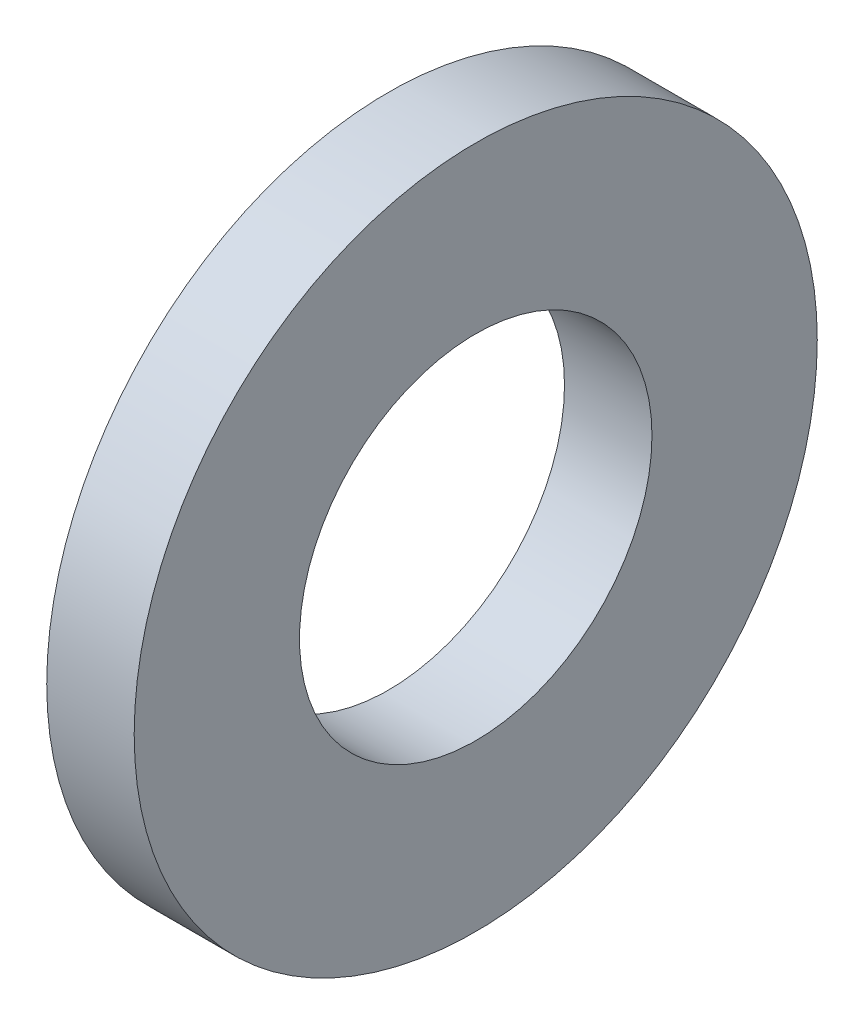
from build123d import *

# Parameters (mm, degrees)
SKETCH1_R          = 3.905
SKETCH1_R_2        = 2.015
BASE_EXTRUDE_DEPTH = 1


with BuildPart() as part:
    # Sketch1 → Base-Extrude (new body)
    with BuildSketch(Plane(origin=(0, 0, 0), x_dir=(0, 0, -1), z_dir=(1, 0, 0))):
        Circle(SKETCH1_R)
        Circle(SKETCH1_R_2, mode=Mode.SUBTRACT)
    extrude(amount=BASE_EXTRUDE_DEPTH)


solid = part.part
